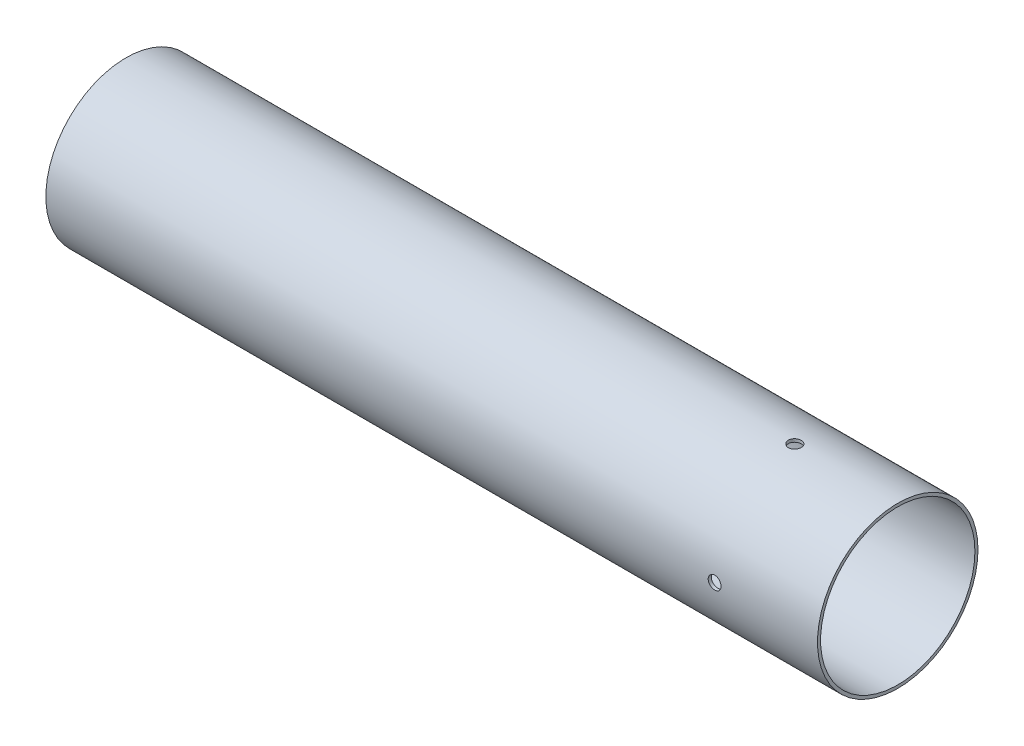
from build123d import *

# Parameters (mm, degrees)
SKETCH1_R           = 39.624
SKETCH1_R_2         = 38.1
BOSS_EXTRUDE1_DEPTH = 381
SKETCH2_R           = 3.175
CUT_EXTRUDE1_DEPTH  = 386.098848027
CIRPATTERN1_COUNT   = 4


with BuildPart() as part:
    # Sketch1 → Boss-Extrude1 (new body)
    with BuildSketch(Plane.YZ):
        with Locations(Location((0, 0, 0), (0, 0, 270))):
            Circle(SKETCH1_R)
        with Locations(Location((0, 0, 0), (0, 0, 270))):
            Circle(SKETCH1_R_2, mode=Mode.SUBTRACT)
    extrude(amount=BOSS_EXTRUDE1_DEPTH)

    # Sketch2 → Cut-Extrude1 (cut, through all)
    with BuildSketch(Plane(origin=(0, 0, 0), x_dir=(-1, 0, 0), z_dir=(0, 1, 0))):
        with Locations(Location((-330.2, 0, 0), (0, 0, 270))):
            Circle(SKETCH2_R)
    cut_extrude1 = extrude(amount=CUT_EXTRUDE1_DEPTH, mode=Mode.SUBTRACT)

    # CirPattern1: Cut-Extrude1 ×4 about axis
    cirpattern1_axis = Axis((381, 0, 0), (-1, 0, 0))
    for i in range(1, CIRPATTERN1_COUNT):
        add(cut_extrude1.rotate(cirpattern1_axis, i * 360 / CIRPATTERN1_COUNT), mode=Mode.SUBTRACT)


solid = part.part
